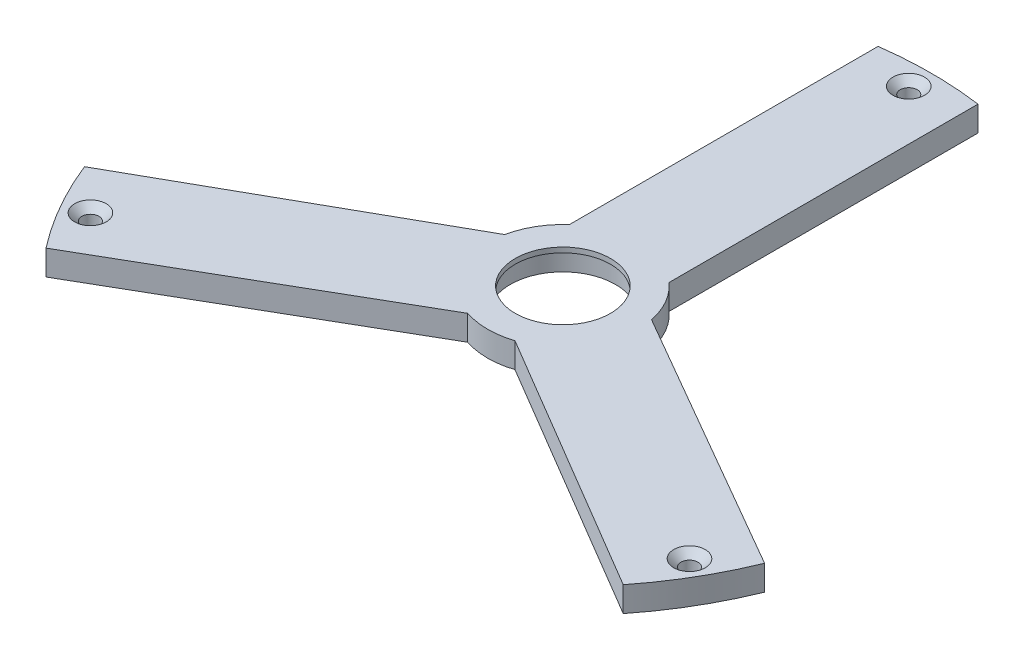
from build123d import *

# Parameters (mm, degrees)
SALIENTE_EXTRUIR1_DEPTH                         = 5
CROQUIS6_R                                      = 1.6
CORTAR_EXTRUIR4_DEPTH                           = 10
CROQUIS8_R                                      = 10.5
CORTAR_EXTRUIR5_DEPTH                           = 4
CROQUIS9_R                                      = 9.5
CORTAR_EXTRUIR6_DEPTH                           = 4
CSK_FOR_M3_FLAT_HEAD_MACHINE_SCREW1_D           = 3.4
CSK_FOR_M3_FLAT_HEAD_MACHINE_SCREW1_CSINK_D     = 6.3
CSK_FOR_M3_FLAT_HEAD_MACHINE_SCREW1_CSINK_ANGLE = 90


with BuildPart() as part:
    # Croquis1 → Saliente-Extruir1 (new body)
    with BuildSketch(Plane(origin=(0, 0, 0), x_dir=(1, 0, 0), z_dir=(0, 1, 0))):
        with BuildLine():
            Line((-9.944316368, 11.229896347), (-9.944316368, 72.824175738))
            ThreePointArc((-9.944316368, 72.824175738), (0.028101663, 73.499994628), (10, 72.816550317))
            Line((10, 72.816550317), (10, 11.180339887))
            ThreePointArc((10, 11.180339887), (13.008976456, 7.467699215), (14.697533703, 2.997082424))
            Line((14.697533703, 2.997082424), (68.039744383, -27.800057271))
            ThreePointArc((68.039744383, -27.800057271), (63.468798846, -37.066987644), (57.643462165, -45.601329691))
            Line((57.643462165, -45.601329691), (4.689417529, -14.24813543))
            ThreePointArc((4.689417529, -14.24813543), (-0.033608107, -14.99996235), (-4.753217335, -14.226978772))
            Line((-4.753217335, -14.226978772), (-58.095428015, -45.024118467))
            ThreePointArc((-58.095428015, -45.024118467), (-63.835352365, -36.432098327), (-68.313641042, -27.120037751))
            Line((-68.313641042, -27.120037751), (-14.68380565, 3.06363373))
            ThreePointArc((-14.68380565, 3.06363373), (-12.973359619, 7.529405035), (-9.944316368, 11.229896347))
        make_face()
    extrude(amount=SALIENTE_EXTRUIR1_DEPTH)

    # Croquis6 → Cortar-Extruir4 (cut, symmetric)
    with BuildSketch(Plane(origin=(0, 5, 0), x_dir=(1, 0, 0), z_dir=(0, 1, 0))):
        with Locations(Location((0, 69, 0), (0, 0, 270))):
            Circle(CROQUIS6_R)
        with Locations(Location((59.755752861, -34.5, 0), (0, 0, 270))):
            Circle(CROQUIS6_R)
        with Locations(Location((-59.755752861, -34.5, 0), (0, 0, 270))):
            Circle(CROQUIS6_R)
    extrude(amount=CORTAR_EXTRUIR4_DEPTH, both=True, mode=Mode.SUBTRACT)

    # Croquis8 → Cortar-Extruir5 (cut)
    with BuildSketch(Plane.XZ):
        with Locations(Location((0, 0, 0), (0, 0, 270))):
            Circle(CROQUIS8_R)
    extrude(amount=-CORTAR_EXTRUIR5_DEPTH, mode=Mode.SUBTRACT)

    # Croquis9 → Cortar-Extruir6 (cut)
    with BuildSketch(Plane(origin=(0, 5, 0), x_dir=(1, 0, 0), z_dir=(0, 1, 0))):
        with Locations(Location((0, 0, 0), (0, 0, 270))):
            Circle(CROQUIS9_R)
    extrude(amount=-CORTAR_EXTRUIR6_DEPTH, mode=Mode.SUBTRACT)

    # CSK for M3 Flat Head Machine Screw1 (through all)
    with Locations(Plane(origin=(0, 5, 0), x_dir=(1, 0, 0), z_dir=(0, 1, 0))):
        with Locations((-59.755752861, -34.5), (0, 69), (59.755752861, -34.5)):
            CounterSinkHole(CSK_FOR_M3_FLAT_HEAD_MACHINE_SCREW1_D / 2, CSK_FOR_M3_FLAT_HEAD_MACHINE_SCREW1_CSINK_D / 2, counter_sink_angle=CSK_FOR_M3_FLAT_HEAD_MACHINE_SCREW1_CSINK_ANGLE)


solid = part.part
